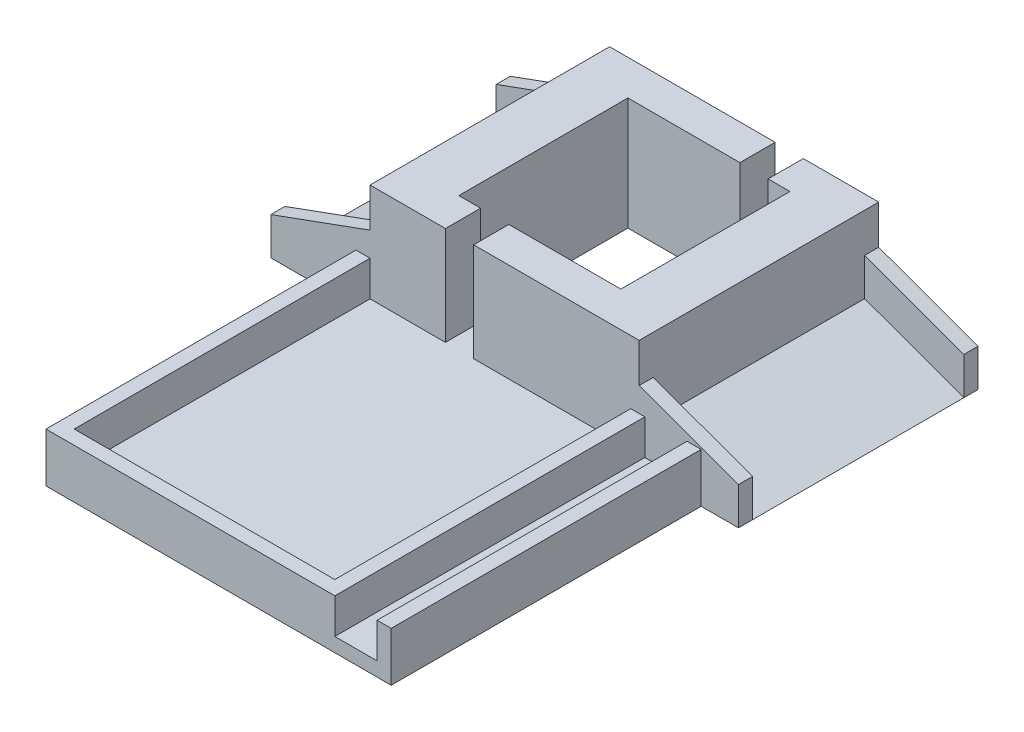
from build123d import *

# Parameters (mm, degrees)
BOSS_EXTRUDE1_DEPTH            = 34
BOSS_EXTRUDE1_2_DEPTH          = 34
SKETCH5_W                      = 38.2
SKETCH5_H                      = 34
BOSS_EXTRUDE2_DEPTH            = 16
BOSS_EXTRUDE7_REACH            = 77.954
SKETCH12_W                     = 2
SKETCH12_H                     = 5
BOSS_EXTRUDE8_REACH            = 79.938
SKETCH13_W                     = 2
SKETCH13_H                     = 5
CUT_EXTRUDE1_START             = 2
SKETCH6_W                      = 4
SKETCH6_H                      = 5
CUT_EXTRUDE1_DEPTH             = 14
SKETCH7_W                      = 49
SKETCH7_H                      = 44
BOSS_EXTRUDE3_DEPTH            = 2
SKETCH8_W                      = 10
SKETCH8_H                      = 5
SKETCH8_W_2                    = 2
BOSS_EXTRUDE5_DEPTH            = 45
CUT_EXTRUDE2_REACH             = 97.297
SKETCH9_W                      = 6
SKETCH9_H                      = 44
CUT_EXTRUDE2_DIRECTION_2_REACH = 97.297
SKETCH10_W                     = 23
SKETCH10_H                     = 24
CUT_EXTRUDE3_DEPTH             = 16
SKETCH11_W                     = 2
SKETCH11_H                     = 5
BOSS_EXTRUDE6_DEPTH            = 37
SKETCH14_W                     = 5
SKETCH14_H                     = 34
CUT_EXTRUDE4_DEPTH             = 5.320889


with BuildPart() as part:
    # Sketch4 → Boss-Extrude1 (new body)
    with BuildSketch(Plane.XY):
        Polygon((0, 0), (-14.095389312, 0), (0, 5.13030215), align=None)
    extrude(amount=BOSS_EXTRUDE1_DEPTH)



with BuildPart() as body_2:
    # Sketch4 → Boss-Extrude1 2 (new body)
    with BuildSketch(Plane.XY):
        Polygon((52.295389312, 0), (38.2, 5.13030215), (38.2, 0), align=None)
    extrude(amount=BOSS_EXTRUDE1_2_DEPTH)


with BuildPart() as part_1:
    add(part.part)

    add(body_2.part)  # Boss-Extrude2 merges body 2
    # Sketch5 → Boss-Extrude2 (add)
    with BuildSketch(Plane(origin=(0, 0, 0), x_dir=(1, 0, 0), z_dir=(0, 1, 0))):
        with Locations((19.1, -17)):
            Rectangle(SKETCH5_W, SKETCH5_H)
    extrude(amount=BOSS_EXTRUDE2_DEPTH)

    # Boss-Extrude7: up to this plane
    boss_extrude7_end = Plane(origin=(0, 16, 0), z_dir=(1, 0, 0))
    # Sketch12 → Boss-Extrude7 (add, up to the surface)
    with BuildSketch(Plane(origin=(-12.446541984, -4.530170802, 0), x_dir=(0, 0, -1), z_dir=(0.9396926207859105, 0.3420201433256627, 0)), mode=Mode.PRIVATE) as boss_extrude7_sk1:
        with Locations((-1, 7.320907073)):
            Rectangle(SKETCH12_W, SKETCH12_H)
    boss_extrude7_tool1 = split(extrude(boss_extrude7_sk1.sketch, amount=BOSS_EXTRUDE7_REACH, mode=Mode.PRIVATE), bisect_by=boss_extrude7_end, keep=Keep.BOTH, mode=Mode.PRIVATE)
    add(boss_extrude7_tool1.solids().sort_by_distance((-14.95044, 2.349232, 1))[0])
    # Sketch12 → Boss-Extrude7 (add, up to the surface)
    with BuildSketch(Plane(origin=(-12.446541984, -4.530170802, 0), x_dir=(0, 0, -1), z_dir=(0.9396926207859105, 0.3420201433256627, 0)), mode=Mode.PRIVATE) as boss_extrude7_sk2:
        with Locations((-33, 7.320907073)):
            Rectangle(SKETCH12_W, SKETCH12_H)
    boss_extrude7_tool2 = split(extrude(boss_extrude7_sk2.sketch, amount=BOSS_EXTRUDE7_REACH, mode=Mode.PRIVATE), bisect_by=boss_extrude7_end, keep=Keep.BOTH, mode=Mode.PRIVATE)
    add(boss_extrude7_tool2.solids().sort_by_distance((-14.95044, 2.349232, 33))[0])

    # Boss-Extrude8: up to this plane
    boss_extrude8_end = Plane(origin=(38.2, 16, 0), z_dir=(-1, 0, 0))
    # Sketch13 → Boss-Extrude8 (add, up to the surface)
    with BuildSketch(Plane(origin=(46.177990847, -16.807414147, 0), x_dir=(0, 0, -1), z_dir=(0.9396926207859105, -0.3420201433256628, 0)), mode=Mode.PRIVATE) as boss_extrude8_sk1:
        with Locations((-33, 20.386076548)):
            Rectangle(SKETCH13_W, SKETCH13_H)
    boss_extrude8_tool1 = split(extrude(boss_extrude8_sk1.sketch, amount=-BOSS_EXTRUDE8_REACH, mode=Mode.PRIVATE), bisect_by=boss_extrude8_end, keep=Keep.BOTH, mode=Mode.PRIVATE)
    add(boss_extrude8_tool1.solids().sort_by_distance((53.15044, 2.349232, 33))[0])
    # Sketch13 → Boss-Extrude8 (add, up to the surface)
    with BuildSketch(Plane(origin=(46.177990847, -16.807414147, 0), x_dir=(0, 0, -1), z_dir=(0.9396926207859105, -0.3420201433256628, 0)), mode=Mode.PRIVATE) as boss_extrude8_sk2:
        with Locations((-1, 20.386076548)):
            Rectangle(SKETCH13_W, SKETCH13_H)
    boss_extrude8_tool2 = split(extrude(boss_extrude8_sk2.sketch, amount=-BOSS_EXTRUDE8_REACH, mode=Mode.PRIVATE), bisect_by=boss_extrude8_end, keep=Keep.BOTH, mode=Mode.PRIVATE)
    add(boss_extrude8_tool2.solids().sort_by_distance((53.15044, 2.349232, 1))[0])

    # Sketch6 → Cut-Extrude1 (cut)
    with BuildSketch(Plane(origin=(0, 0, 0), x_dir=(1, 0, 0), z_dir=(0, 1, 0)).offset(CUT_EXTRUDE1_START)):
        with Locations((12.7, -31.5)):
            Rectangle(SKETCH6_W, SKETCH6_H)
        with Locations((25.5, -2.5)):
            Rectangle(SKETCH6_W, SKETCH6_H)
    extrude(amount=CUT_EXTRUDE1_DEPTH, mode=Mode.SUBTRACT)

    # Sketch7 → Boss-Extrude3 (add)
    with BuildSketch(Plane(origin=(0, 0, 0), x_dir=(1, 0, 0), z_dir=(0, 1, 0))):
        with Locations((22.5, -56)):
            Rectangle(SKETCH7_W, SKETCH7_H)
    extrude(amount=BOSS_EXTRUDE3_DEPTH)

    # Sketch8 → Boss-Extrude5 (add)
    with BuildSketch(Plane.XY.offset(78)):
        with Locations((42, 4.5)):
            Rectangle(SKETCH8_W, SKETCH8_H)
        with Locations((-1, 4.5)):
            Rectangle(SKETCH8_W_2, SKETCH8_H)
    extrude(amount=-BOSS_EXTRUDE5_DEPTH)

    # Cut-Extrude2: up to this face of the body (flat: up to its plane)
    cut_extrude2_end = Plane(part_1.part.faces().sort_by_distance((18.42961165, 2, 55.702669903))[0])
    # Sketch9 → Cut-Extrude2 (cut, up to the picked face)
    with BuildSketch(Plane(origin=(0, 7, 0), x_dir=(1, 0, 0), z_dir=(0, 1, 0)), mode=Mode.PRIVATE) as cut_extrude2_sk1:
        with Locations((42, -56)):
            Rectangle(SKETCH9_W, SKETCH9_H)
    cut_extrude2_tool1 = split(extrude(cut_extrude2_sk1.sketch, amount=-CUT_EXTRUDE2_REACH, mode=Mode.PRIVATE), bisect_by=cut_extrude2_end, keep=Keep.BOTH, mode=Mode.PRIVATE)
    add(cut_extrude2_tool1.solids().sort_by(Axis((42, 7, 56), (0, -1, 0)))[0], mode=Mode.SUBTRACT)

    # Cut-Extrude2 direction 2: up to this face of the body (flat: up to its plane)
    cut_extrude2_direction_2_end = Plane(part_1.part.faces().sort_by_distance((46.102745014, 7.574827058, 33))[0])
    # Sketch9 → Cut-Extrude2 direction 2 (cut, up to the picked face)
    with BuildSketch(Plane(origin=(0, 7, 0), x_dir=(1, 0, 0), z_dir=(0, 1, 0)), mode=Mode.PRIVATE) as cut_extrude2_direction_2_sk1:
        with Locations((42, -56)):
            Rectangle(SKETCH9_W, SKETCH9_H)
    cut_extrude2_direction_2_tool1 = split(extrude(cut_extrude2_direction_2_sk1.sketch, amount=CUT_EXTRUDE2_DIRECTION_2_REACH, mode=Mode.PRIVATE), bisect_by=cut_extrude2_direction_2_end, keep=Keep.BOTH, mode=Mode.PRIVATE)
    add(cut_extrude2_direction_2_tool1.solids().sort_by(Axis((42, 7, 56), (0, 1, 0)))[0], mode=Mode.SUBTRACT)

    # Sketch10 → Cut-Extrude3 (cut)
    with BuildSketch(Plane(origin=(0, 16, 0), x_dir=(1, 0, 0), z_dir=(0, 1, 0))):
        with Locations((19.1, -17)):
            Rectangle(SKETCH10_W, SKETCH10_H)
    extrude(amount=-CUT_EXTRUDE3_DEPTH, mode=Mode.SUBTRACT)

    # Sketch11 → Boss-Extrude6 (add)
    with BuildSketch(Plane(origin=(0, 0, 0), x_dir=(0, 0, -1), z_dir=(1, 0, 0))):
        with Locations((-77, 4.5)):
            Rectangle(SKETCH11_W, SKETCH11_H)
    extrude(amount=BOSS_EXTRUDE6_DEPTH)

    # Sketch14 → Cut-Extrude4 (cut)
    with BuildSketch(Plane(origin=(0, 0, 0), x_dir=(1, 0, 0), z_dir=(0, 1, 0))):
        with Locations((-16.595389312, -17)):
            Rectangle(SKETCH14_W, SKETCH14_H)
        with Locations((54.795389312, -17)):
            Rectangle(SKETCH14_W, SKETCH14_H)
    extrude(amount=CUT_EXTRUDE4_DEPTH, mode=Mode.SUBTRACT)


solid = part_1.part
